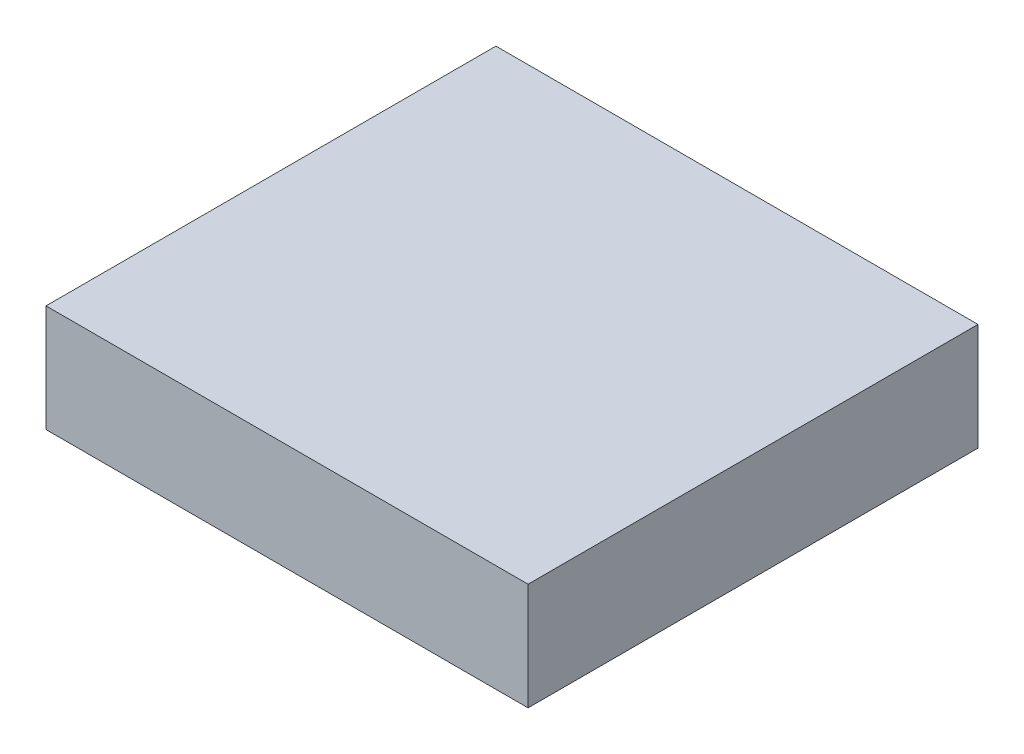
from build123d import *

# Parameters (mm, degrees)
CROQUIS1_W              = 45
CROQUIS1_H              = 42
SALIENTE_EXTRUIR1_DEPTH = 10


with BuildPart() as part:
    # Croquis1 → Saliente-Extruir1 (new body)
    with BuildSketch(Plane(origin=(0, 0, 0), x_dir=(1, 0, 0), z_dir=(0, 1, 0))):
        Rectangle(CROQUIS1_W, CROQUIS1_H)
    extrude(amount=SALIENTE_EXTRUIR1_DEPTH)


solid = part.part
